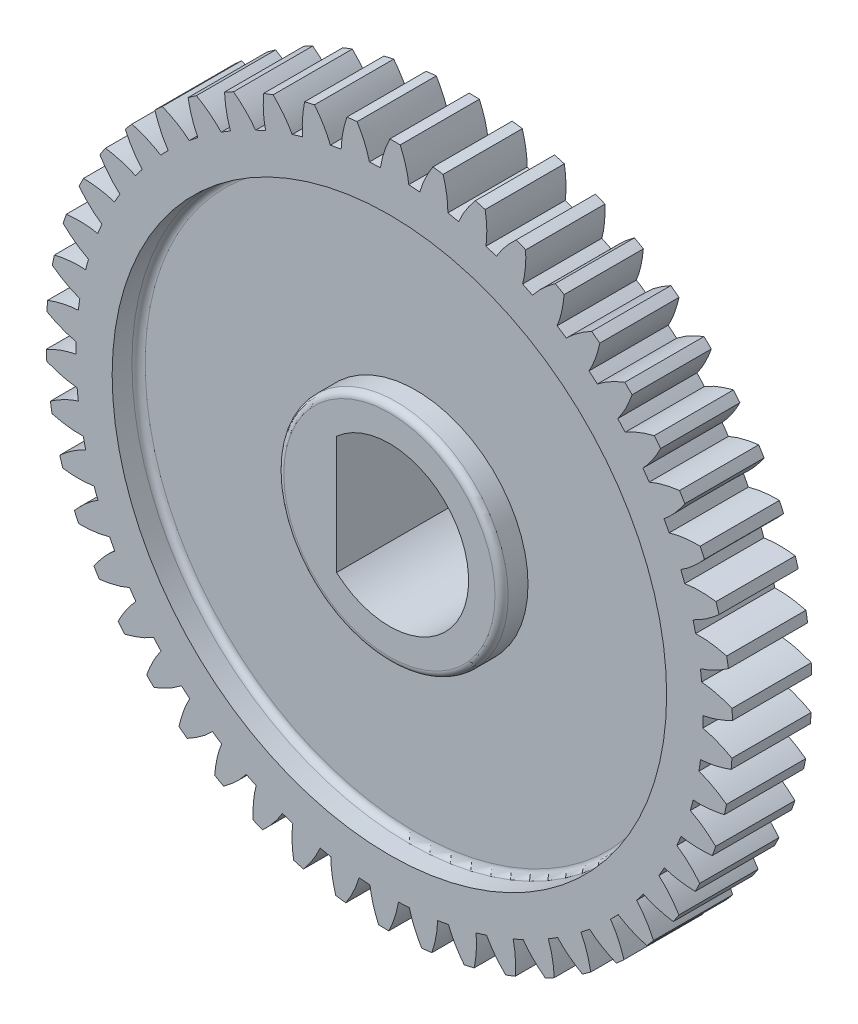
from build123d import *

# Parameters (mm, degrees)
BOSS_EXTRU_1_DEPTH      = 3
ESQUISSE2_R             = 10.5
ESQUISSE2_R_2           = 4.25
ENL_V_MAT_EXTRU_1_DEPTH = 1
ESQUISSE3_R             = 4.25
BOSS_EXTRU_2_DEPTH      = 3.3
BOSS_EXTRU_3_DEPTH      = 1.75
CONG_1_R                = 0.25


with BuildPart() as part:
    # Esquisse1 → Boss.-Extru.1 (new body)
    with BuildSketch(Plane.XY):
        with BuildLine():
            ThreePointArc((12.99358489, 0.408352439), (12.986055843, 0.601958181), (12.975642211, 0.795430209))
            add(Edge.make_bspline(
                [(11.825183943, 1.086577062), (11.84274004, 1.085334297), (12.058734776, 1.065812313), (12.434577724, 0.990975057), (12.793560897, 0.867739829), (12.961964929, 0.800917402), (12.975642211, 0.795430209)],
                knots=[0.129627803, 0.129627803, 0.129627803, 0.129627803, 0.182246376, 0.777177078, 1.275526536, 1.319644943, 1.319644943, 1.319644943, 1.319644943], degree=3))
            ThreePointArc((11.825183943, 1.086577062), (11.804328734, 1.29361824), (11.779848826, 1.500262192))
            add(Edge.make_bspline(
                [(11.779848826, 1.500262192), (11.796719089, 1.505277688), (12.003359366, 1.571115594), (12.354074026, 1.725575182), (12.677847228, 1.923632631), (12.827782192, 2.025341339), (12.83994646, 2.033660468)],
                knots=[0.129627803, 0.129627803, 0.129627803, 0.129627803, 0.182246376, 0.777177078, 1.275526536, 1.319644943, 1.319644943, 1.319644943, 1.319644943], degree=3))
            ThreePointArc((12.83994646, 2.033660468), (12.808211548, 2.22479593), (12.773631556, 2.415437201))
            add(Edge.make_bspline(
                [(11.595754619, 2.560097618), (11.61332804, 2.561065016), (11.830066347, 2.568768287), (12.212325257, 2.541626756), (12.58392321, 2.464355798), (12.759374396, 2.419166907), (12.773631556, 2.415437201)],
                knots=[0.129627803, 0.129627803, 0.129627803, 0.129627803, 0.182246376, 0.777177078, 1.275526536, 1.319644943, 1.319644943, 1.319644943, 1.319644943], degree=3))
            ThreePointArc((11.595754619, 2.560097618), (11.549114719, 2.762892364), (11.498928487, 2.964838721))
            add(Edge.make_bspline(
                [(11.498928487, 2.964838721), (11.515037115, 2.971929073), (11.711796295, 3.063146721), (12.040386545, 3.260344552), (12.336783518, 3.497419801), (12.472788719, 3.617118339), (12.483814405, 3.626896456)],
                knots=[0.129627803, 0.129627803, 0.129627803, 0.129627803, 0.182246376, 0.777177078, 1.275526536, 1.319644943, 1.319644943, 1.319644943, 1.319644943], degree=3))
            ThreePointArc((12.483814405, 3.626896456), (12.428374107, 3.81254732), (12.370173101, 3.997351304))
            add(Edge.make_bspline(
                [(11.183453318, 3.993243906), (11.20076692, 3.996406209), (11.414830705, 4.03121325), (11.797477125, 4.052195484), (12.175829536, 4.022107403), (12.355560907, 3.999264705), (12.370173101, 3.997351304)],
                knots=[0.129627803, 0.129627803, 0.129627803, 0.129627803, 0.182246376, 0.777177078, 1.275526536, 1.319644943, 1.319644943, 1.319644943, 1.319644943], degree=3))
            ThreePointArc((11.183453318, 3.993243906), (11.111764266, 4.188594025), (11.036663178, 4.382657972))
            add(Edge.make_bspline(
                [(11.036663178, 4.382657972), (11.051756128, 4.391711361), (11.235531199, 4.506870195), (11.536814975, 4.74369634), (11.801161363, 5.016050571), (11.921091917, 5.151851223), (11.930805139, 5.162934121)],
                knots=[0.129627803, 0.129627803, 0.129627803, 0.129627803, 0.182246376, 0.777177078, 1.275526536, 1.319644943, 1.319644943, 1.319644943, 1.319644943], degree=3))
            ThreePointArc((11.930805139, 5.162934121), (11.852533781, 5.34017256), (11.771629627, 5.51622479))
            add(Edge.make_bspline(
                [(10.594782277, 5.363414352), (10.611563014, 5.368721689), (10.819576363, 5.430083573), (11.196575731, 5.498858668), (11.575715757, 5.516427972), (11.756892842, 5.516291709), (11.771629627, 5.51622479)],
                knots=[0.129627803, 0.129627803, 0.129627803, 0.129627803, 0.182246376, 0.777177078, 1.275526536, 1.319644943, 1.319644943, 1.319644943, 1.319644943], degree=3))
            ThreePointArc((10.594782277, 5.363414352), (10.499174652, 5.548239056), (10.400343097, 5.731360089))
            add(Edge.make_bspline(
                [(10.400343097, 5.731360089), (10.414182344, 5.742233737), (10.582075065, 5.879517634), (10.851300942, 6.152237204), (11.079427843, 6.455575228), (11.181392374, 6.605336334), (11.189639949, 6.61754923)],
                knots=[0.129627803, 0.129627803, 0.129627803, 0.129627803, 0.182246376, 0.777177078, 1.275526536, 1.319644943, 1.319644943, 1.319644943, 1.319644943], degree=3))
            ThreePointArc((11.189639949, 6.61754923), (11.089771917, 6.783580089), (10.987440521, 6.948104115))
            add(Edge.make_bspline(
                [(9.83902519, 6.649000549), (9.855008421, 6.65636922), (10.053690839, 6.743318233), (10.419097649, 6.858801566), (10.793046025, 6.923751176), (10.972811553, 6.946323498), (10.987440521, 6.948104115)],
                knots=[0.129627803, 0.129627803, 0.129627803, 0.129627803, 0.182246376, 0.777177078, 1.275526536, 1.319644943, 1.319644943, 1.319644943, 1.319644943], degree=3))
            ThreePointArc((9.83902519, 6.649000549), (9.721006783, 6.820385043), (9.600003392, 6.989675233))
            add(Edge.make_bspline(
                [(9.600003392, 6.989675233), (9.612370683, 7.002197657), (9.761733286, 7.159441567), (9.994655411, 7.463753611), (10.182965127, 7.793291607), (10.265355594, 7.954651347), (10.272007452, 7.967801635)],
                knots=[0.129627803, 0.129627803, 0.129627803, 0.129627803, 0.182246376, 0.777177078, 1.275526536, 1.319644943, 1.319644943, 1.319644943, 1.319644943], degree=3))
            ThreePointArc((10.272007452, 7.967801635), (10.152117726, 8.120006508), (10.029972915, 8.270407688))
            add(Edge.make_bspline(
                [(8.928100799, 7.829728036), (8.943034458, 7.839041833), (9.129252605, 7.950206737), (9.477304173, 8.110577067), (9.84016351, 8.221882688), (10.015682471, 8.266807616), (10.029972915, 8.270407688)],
                knots=[0.129627803, 0.129627803, 0.129627803, 0.129627803, 0.182246376, 0.777177078, 1.275526536, 1.319644943, 1.319644943, 1.319644943, 1.319644943], degree=3))
            ThreePointArc((8.928100799, 7.829728036), (8.789532829, 7.984969483), (8.6482659, 8.137759024))
            add(Edge.make_bspline(
                [(8.6482659, 8.137759024), (8.658966195, 8.151732737), (8.787443141, 8.326456829), (8.980388193, 8.657562166), (9.125910968, 9.008103121), (9.187428024, 9.178516755), (9.192379262, 9.192397049)],
                knots=[0.129627803, 0.129627803, 0.129627803, 0.129627803, 0.182246376, 0.777177078, 1.275526536, 1.319644943, 1.319644943, 1.319644943, 1.319644943], degree=3))
            ThreePointArc((9.192379262, 9.192397049), (9.054358573, 9.328375573), (8.914326644, 9.462281991))
            add(Edge.make_bspline(
                [(7.876374925, 8.886976035), (7.890023499, 8.898088073), (8.060840604, 9.031715731), (8.386047949, 9.234443921), (8.732095738, 9.390350199), (8.900600093, 9.456919239), (8.914326644, 9.462281991)],
                knots=[0.129627803, 0.129627803, 0.129627803, 0.129627803, 0.182246376, 0.777177078, 1.275526536, 1.319644943, 1.319644943, 1.319644943, 1.319644943], degree=3))
            ThreePointArc((7.876374925, 8.886976035), (7.719442692, 9.023626185), (7.560140088, 9.157505493))
            add(Edge.make_bspline(
                [(7.560140088, 9.157505493), (7.569004637, 9.172710122), (7.674569769, 9.362158894), (7.824494889, 9.714835793), (7.924935742, 10.080851468), (7.964609225, 10.257631471), (7.96778176, 10.272022869)],
                knots=[0.129627803, 0.129627803, 0.129627803, 0.129627803, 0.182246376, 0.777177078, 1.275526536, 1.319644943, 1.319644943, 1.319644943, 1.319644943], degree=3))
            ThreePointArc((7.96778176, 10.272022869), (7.813806777, 10.389630583), (7.658096117, 10.504930455))
            add(Edge.make_bspline(
                [(6.700433913, 9.804071112), (6.712582157, 9.816806149), (6.865304331, 9.970789173), (7.16253874, 10.212678079), (7.486317601, 10.410726278), (7.645149935, 10.497889597), (7.658096117, 10.504930455)],
                knots=[0.129627803, 0.129627803, 0.129627803, 0.129627803, 0.182246376, 0.777177078, 1.275526536, 1.319644943, 1.319644943, 1.319644943, 1.319644943], degree=3))
            ThreePointArc((6.700433913, 9.804071112), (6.527612333, 9.919974911), (6.35278635, 10.03283263))
            add(Edge.make_bspline(
                [(6.35278635, 10.03283263), (6.359675355, 10.049028389), (6.440663846, 10.25021412), (6.545204626, 10.618900656), (6.598979545, 10.994618766), (6.616183782, 11.174977212), (6.617527579, 11.189652753)],
                knots=[0.129627803, 0.129627803, 0.129627803, 0.129627803, 0.182246376, 0.777177078, 1.275526536, 1.319644943, 1.319644943, 1.319644943, 1.319644943], degree=3))
            ThreePointArc((6.617527579, 11.189652753), (6.45002658, 11.287034913), (6.28109284, 11.38190989))
            add(Edge.make_bspline(
                [(5.418823056, 10.566550132), (5.429279383, 10.580707328), (5.561498107, 10.752617314), (5.826072015, 11.029852203), (6.122475762, 11.266918984), (6.269131196, 11.373301964), (6.28109284, 11.38190989)],
                knots=[0.129627803, 0.129627803, 0.129627803, 0.129627803, 0.182246376, 0.777177078, 1.275526536, 1.319644943, 1.319644943, 1.319644943, 1.319644943], degree=3))
            ThreePointArc((5.418823056, 10.566550132), (5.232837628, 10.659879707), (5.045245377, 10.749936004))
            add(Edge.make_bspline(
                [(5.045245377, 10.749936004), (5.050050193, 10.766867475), (5.105184808, 10.976617346), (5.162692576, 11.355499113), (5.168953499, 11.734994358), (5.163417168, 11.916086886), (5.162911036, 11.930815129)],
                knots=[0.129627803, 0.129627803, 0.129627803, 0.129627803, 0.182246376, 0.777177078, 1.275526536, 1.319644943, 1.319644943, 1.319644943, 1.319644943], degree=3))
            ThreePointArc((5.162911036, 11.930815129), (4.984525611, 12.006435959), (4.805032976, 12.079389806))
            add(Edge.make_bspline(
                [(4.051754122, 11.162388344), (4.060353631, 11.177744431), (4.169983736, 11.364870256), (4.397724655, 11.673078969), (4.662078824, 11.945425647), (4.794244512, 12.069350565), (4.805032976, 12.079389806)],
                knots=[0.129627803, 0.129627803, 0.129627803, 0.129627803, 0.182246376, 0.777177078, 1.275526536, 1.319644943, 1.319644943, 1.319644943, 1.319644943], degree=3))
            ThreePointArc((4.051754122, 11.162388344), (3.855537947, 11.231671832), (3.65813787, 11.297506465))
            add(Edge.make_bspline(
                [(3.65813787, 11.297506465), (3.660782722, 11.31490663), (3.689193955, 11.52991276), (3.698761781, 11.913014565), (3.657409968, 12.290302078), (3.62922038, 12.469272751), (3.626872301, 12.483821423)],
                knots=[0.129627803, 0.129627803, 0.129627803, 0.129627803, 0.182246376, 0.777177078, 1.275526536, 1.319644943, 1.319644943, 1.319644943, 1.319644943], degree=3))
            ThreePointArc((3.626872301, 12.483821423), (3.440415695, 12.536488338), (3.253194872, 12.58637053))
            add(Edge.make_bspline(
                [(2.620786605, 11.582189023), (2.627393676, 11.598501828), (2.712706231, 11.797892405), (2.90002255, 12.132214306), (3.128158117, 12.435545812), (3.243749729, 12.575058298), (3.253194872, 12.58637053)],
                knots=[0.129627803, 0.129627803, 0.129627803, 0.129627803, 0.182246376, 0.777177078, 1.275526536, 1.319644943, 1.319644943, 1.319644943, 1.319644943], degree=3))
            ThreePointArc((2.620786605, 11.582189023), (2.417434129, 11.626333783), (2.213339344, 11.6669085))
            add(Edge.make_bspline(
                [(2.213339344, 11.6669085), (2.213782522, 11.684502947), (2.21502231, 11.901374562), (2.176499302, 12.282654661), (2.088186897, 12.651784393), (2.037788619, 12.825810737), (2.033635623, 12.839950395)],
                knots=[0.129627803, 0.129627803, 0.129627803, 0.129627803, 0.182246376, 0.777177078, 1.275526536, 1.319644943, 1.319644943, 1.319644943, 1.319644943], degree=3))
            ThreePointArc((2.033635623, 12.839950395), (1.842048369, 12.868832807), (1.650051941, 12.894856672))
            add(Edge.make_bspline(
                [(1.148487718, 11.819331663), (1.152998154, 11.836343922), (1.212647728, 12.044854743), (1.356585356, 12.400017376), (1.544904488, 12.729549991), (1.642099075, 12.88244985), (1.650051941, 12.894856672)],
                knots=[0.129627803, 0.129627803, 0.129627803, 0.129627803, 0.182246376, 0.777177078, 1.275526536, 1.319644943, 1.319644943, 1.319644943, 1.319644943], degree=3))
            ThreePointArc((1.148487718, 11.819331663), (0.941205932, 11.837641505), (0.733635134, 11.852316419))
            add(Edge.make_bspline(
                [(0.733635134, 11.852316419), (0.731869648, 11.869827674), (0.70591844, 12.085144577), (0.61991213, 12.458589956), (0.486031871, 12.81374051), (0.414219715, 12.980078025), (0.408327297, 12.99358568)],
                knots=[0.129627803, 0.129627803, 0.129627803, 0.129627803, 0.182246376, 0.777177078, 1.275526536, 1.319644943, 1.319644943, 1.319644943, 1.319644943], degree=3))
            ThreePointArc((0.408327297, 12.99358568), (0.214630839, 12.998228095), (0.020886706, 12.999983221))
            add(Edge.make_bspline(
                [(-0.341923507, 11.870076382), (-0.339580838, 11.887519802), (-0.306534955, 12.101862526), (-0.208245998, 12.472264764), (-0.062713207, 12.822801562), (0.014551537, 12.986677472), (0.020886706, 12.999983221)],
                knots=[0.129627803, 0.129627803, 0.129627803, 0.129627803, 0.182246376, 0.777177078, 1.275526536, 1.319644943, 1.319644943, 1.319644943, 1.319644943], degree=3))
            ThreePointArc((-0.341923507, 11.870076382), (-0.549865646, 11.862262549), (-0.75763894, 11.850806227))
            add(Edge.make_bspline(
                [(-0.75763894, 11.850806227), (-0.761585246, 11.867958127), (-0.814318186, 12.078324643), (-0.946451427, 12.438045845), (-1.123788168, 12.773616285), (-1.215881682, 12.929641729), (-1.223420594, 12.942304356)],
                knots=[0.129627803, 0.129627803, 0.129627803, 0.129627803, 0.182246376, 0.777177078, 1.275526536, 1.319644943, 1.319644943, 1.319644943, 1.319644943], degree=3))
            ThreePointArc((-1.223420594, 12.942304356), (-1.416171547, 12.922633561), (-1.608607925, 12.900092269))
            add(Edge.make_bspline(
                [(-1.826942393, 11.733622906), (-1.826804438, 11.751222393), (-1.820883398, 11.968016709), (-1.769793189, 12.347817087), (-1.669341878, 12.713829893), (-1.613225487, 12.886097433), (-1.608607925, 12.900092269)],
                knots=[0.129627803, 0.129627803, 0.129627803, 0.129627803, 0.182246376, 0.777177078, 1.275526536, 1.319644943, 1.319644943, 1.319644943, 1.319644943], degree=3))
            ThreePointArc((-1.826942393, 11.733622906), (-2.032265513, 11.699808626), (-2.236964595, 11.662401742))
            add(Edge.make_bspline(
                [(-2.236964595, 11.662401742), (-2.243029487, 11.67892379), (-2.321712527, 11.881022314), (-2.49788888, 12.221346321), (-2.715885396, 12.5320445), (-2.826807899, 12.675297259), (-2.835874412, 12.686915162)],
                knots=[0.129627803, 0.129627803, 0.129627803, 0.129627803, 0.182246376, 0.777177078, 1.275526536, 1.319644943, 1.319644943, 1.319644943, 1.319644943], degree=3))
            ThreePointArc((-2.835874412, 12.686915162), (-3.024640061, 12.643241376), (-3.212733849, 12.596759155))
            add(Edge.make_bspline(
                [(-3.283149307, 11.412123187), (-3.28521824, 11.429601187), (-3.306515422, 11.645428118), (-3.303429684, 12.028636958), (-3.24964403, 12.404353531), (-3.215560981, 12.582295939), (-3.212733849, 12.596759155)],
                knots=[0.129627803, 0.129627803, 0.129627803, 0.129627803, 0.182246376, 0.777177078, 1.275526536, 1.319644943, 1.319644943, 1.319644943, 1.319644943], degree=3))
            ThreePointArc((-3.283149307, 11.412123187), (-3.48261534, 11.352841732), (-3.681011983, 11.290074215))
            add(Edge.make_bspline(
                [(-3.681011983, 11.290074215), (-3.689099813, 11.305705849), (-3.792492075, 11.496349166), (-4.009933133, 11.811908864), (-4.265151488, 12.092834888), (-4.393153666, 12.22105578), (-4.403604797, 12.231445736)],
                knots=[0.129627803, 0.129627803, 0.129627803, 0.129627803, 0.182246376, 0.777177078, 1.275526536, 1.319644943, 1.319644943, 1.319644943, 1.319644943], degree=3))
            ThreePointArc((-4.403604797, 12.231445736), (-4.585408195, 12.164457722), (-4.76619304, 12.094767625))
            add(Edge.make_bspline(
                [(-4.687578995, 10.910647468), (-4.691822188, 10.927728343), (-4.740001722, 11.13918417), (-4.78496912, 11.519758039), (-4.778697355, 11.899253104), (-4.767185158, 12.080064121), (-4.76619304, 12.094767625)],
                knots=[0.129627803, 0.129627803, 0.129627803, 0.129627803, 0.182246376, 0.777177078, 1.275526536, 1.319644943, 1.319644943, 1.319644943, 1.319644943], degree=3))
            ThreePointArc((-4.687578995, 10.910647468), (-4.878042242, 10.826833742), (-5.067007613, 10.739695473))
            add(Edge.make_bspline(
                [(-5.067007613, 10.739695473), (-5.076990831, 10.754190173), (-5.203461758, 10.930371724), (-5.458738345, 11.216190549), (-5.747153595, 11.462914045), (-5.890216776, 11.57408095), (-5.901887703, 11.583079105)],
                knots=[0.129627803, 0.129627803, 0.129627803, 0.129627803, 0.182246376, 0.777177078, 1.275526536, 1.319644943, 1.319644943, 1.319644943, 1.319644943], degree=3))
            ThreePointArc((-5.901887703, 11.583079105), (-6.073861703, 11.493833304), (-6.24448652, 11.402034384))
            add(Edge.make_bspline(
                [(-6.018082762, 10.237104321), (-6.024433298, 10.253518695), (-6.098735364, 10.457268632), (-6.191046734, 10.829205653), (-6.232387767, 11.206494348), (-6.243627977, 11.387322477), (-6.24448652, 11.402034384)],
                knots=[0.129627803, 0.129627803, 0.129627803, 0.129627803, 0.182246376, 0.777177078, 1.275526536, 1.319644943, 1.319644943, 1.319644943, 1.319644943], degree=3))
            ThreePointArc((-6.018082762, 10.237104321), (-6.196539504, 10.130080117), (-6.373093505, 10.019945318))
            add(Edge.make_bspline(
                [(-6.373093505, 10.019945318), (-6.38481467, 10.033074494), (-6.53236974, 10.19201579), (-6.821455993, 10.443586208), (-7.138519655, 10.6522162), (-7.294387648, 10.74457595), (-7.307094314, 10.752040396)],
                knots=[0.129627803, 0.129627803, 0.129627803, 0.129627803, 0.182246376, 0.777177078, 1.275526536, 1.319644943, 1.319644943, 1.319644943, 1.319644943], degree=3))
            ThreePointArc((-7.307094314, 10.752040396), (-7.466526783, 10.641944268), (-7.624300717, 10.52948425))
            add(Edge.make_bspline(
                [(-7.253677769, 9.402115923), (-7.262035495, 9.417604932), (-7.361288306, 9.610435722), (-7.499487843, 9.967870226), (-7.587789702, 10.337002481), (-7.621605054, 10.514995954), (-7.624300717, 10.52948425)],
                knots=[0.129627803, 0.129627803, 0.129627803, 0.129627803, 0.182246376, 0.777177078, 1.275526536, 1.319644943, 1.319644943, 1.319644943, 1.319644943], degree=3))
            ThreePointArc((-7.253677769, 9.402115923), (-7.417313637, 9.273569076), (-7.578671906, 9.142174639))
            add(Edge.make_bspline(
                [(-7.578671906, 9.142174639), (-7.591946169, 9.153731237), (-7.758258349, 9.292925679), (-8.076595204, 9.506280274), (-8.417306997, 9.673526543), (-8.58352167, 9.745622569), (-8.597063683, 9.751435588)],
                knots=[0.129627803, 0.129627803, 0.129627803, 0.129627803, 0.182246376, 0.777177078, 1.275526536, 1.319644943, 1.319644943, 1.319644943, 1.319644943], degree=3))
            ThreePointArc((-8.597063683, 9.751435588), (-8.741440276, 9.622225413), (-8.883875138, 9.490877859))
            add(Edge.make_bspline(
                [(-8.374877944, 8.418850541), (-8.385111055, 8.433169913), (-8.507749334, 8.612040499), (-8.689657548, 8.949335531), (-8.82352766, 9.30448991), (-8.879384865, 9.476841664), (-8.883875138, 9.490877859)],
                knots=[0.129627803, 0.129627803, 0.129627803, 0.129627803, 0.182246376, 0.777177078, 1.275526536, 1.319644943, 1.319644943, 1.319644943, 1.319644943], degree=3))
            ThreePointArc((-8.374877944, 8.418850541), (-8.521112302, 8.270808312), (-8.664730124, 8.120226406))
            add(Edge.make_bspline(
                [(-8.664730124, 8.120226406), (-8.679348141, 8.130028169), (-8.861794589, 8.247280579), (-9.204361685, 8.419054622), (-9.563348378, 8.542279593), (-9.737288428, 8.592974898), (-9.751452223, 8.597044815)],
                knots=[0.129627803, 0.129627803, 0.129627803, 0.129627803, 0.182246376, 0.777177078, 1.275526536, 1.319644943, 1.319644943, 1.319644943, 1.319644943], degree=3))
            ThreePointArc((-9.751452223, 8.597044815), (-9.878496034, 8.450758316), (-10.00334554, 8.302594655))
            add(Edge.make_bspline(
                [(-9.364001291, 7.302814856), (-9.375948404, 7.315738767), (-9.520038073, 7.477828253), (-9.742786163, 7.789664468), (-9.920113316, 8.125239975), (-9.997131473, 8.28923192), (-10.00334554, 8.302594655)],
                knots=[0.129627803, 0.129627803, 0.129627803, 0.129627803, 0.182246376, 0.777177078, 1.275526536, 1.319644943, 1.319644943, 1.319644943, 1.319644943], degree=3))
            ThreePointArc((-9.364001291, 7.302814856), (-9.490527937, 7.137611959), (-9.614140372, 6.970217351))
            add(Edge.make_bspline(
                [(-9.614140372, 6.970217351), (-9.629871608, 6.978109701), (-9.825575035, 7.071570937), (-10.186969883, 7.199055449), (-10.558570043, 7.276315791), (-10.73749233, 7.304810879), (-10.752054535, 7.30707351)],
                knots=[0.129627803, 0.129627803, 0.129627803, 0.129627803, 0.182246376, 0.777177078, 1.275526536, 1.319644943, 1.319644943, 1.319644943, 1.319644943], degree=3))
            ThreePointArc((-10.752054535, 7.30707351), (-10.859762008, 7.146017712), (-10.965057208, 6.983374573))
            add(Edge.make_bspline(
                [(-10.205448744, 6.071609419), (-10.218921446, 6.082934051), (-10.382190124, 6.225686188), (-10.642265221, 6.507145743), (-10.860252859, 6.817850151), (-10.957217346, 6.970896036), (-10.965057208, 6.983374573)],
                knots=[0.129627803, 0.129627803, 0.129627803, 0.129627803, 0.182246376, 0.777177078, 1.275526536, 1.319644943, 1.319644943, 1.319644943, 1.319644943], degree=3))
            ThreePointArc((-10.205448744, 6.071609419), (-10.310272276, 5.891851203), (-10.411929882, 5.710283804))
            add(Edge.make_bspline(
                [(-10.411929882, 5.710283804), (-10.428526247, 5.716142275), (-10.634400293, 5.784338398), (-11.008923481, 5.865522871), (-11.387276751, 5.895600142), (-11.568359564, 5.90144563), (-11.583090524, 5.90186529)],
                knots=[0.129627803, 0.129627803, 0.129627803, 0.129627803, 0.182246376, 0.777177078, 1.275526536, 1.319644943, 1.319644943, 1.319644943, 1.319644943], degree=3))
            ThreePointArc((-11.583090524, 5.90186529), (-11.669763047, 5.72858014), (-11.753843373, 5.554022503))
            add(Edge.make_bspline(
                [(-10.885950174, 4.744651074), (-10.900735992, 4.754197831), (-11.080608835, 4.875361334), (-11.373909398, 5.122005443), (-11.629119727, 5.402938758), (-11.744501355, 5.542624958), (-11.753843373, 5.554022503)],
                knots=[0.129627803, 0.129627803, 0.129627803, 0.129627803, 0.182246376, 0.777177078, 1.275526536, 1.319644943, 1.319644943, 1.319644943, 1.319644943], degree=3))
            ThreePointArc((-10.885950174, 4.744651074), (-10.967417462, 4.553172433), (-11.045517039, 4.360295671))
            add(Edge.make_bspline(
                [(-11.045517039, 4.360295671), (-11.062716797, 4.36402787), (-11.275514706, 4.405883386), (-11.657259779, 4.439487493), (-12.036399302, 4.421907357), (-12.216786857, 4.405011057), (-12.231454257, 4.40358113)],
                knots=[0.129627803, 0.129627803, 0.129627803, 0.129627803, 0.182246376, 0.777177078, 1.275526536, 1.319644943, 1.319644943, 1.319644943, 1.319644943], degree=3))
            ThreePointArc((-12.231454257, 4.40358113), (-12.295724953, 4.220799436), (-12.357264407, 4.03708018))
            add(Edge.make_bspline(
                [(-11.394773666, 3.342866747), (-11.41063942, 3.35048507), (-11.604279725, 3.448149118), (-11.926180229, 3.656088057), (-12.21458843, 3.902819794), (-12.346567563, 4.026943374), (-12.357264407, 4.03708018)],
                knots=[0.129627803, 0.129627803, 0.129627803, 0.129627803, 0.182246376, 0.777177078, 1.275526536, 1.319644943, 1.319644943, 1.319644943, 1.319644943], degree=3))
            ThreePointArc((-11.394773666, 3.342866747), (-11.451599924, 3.142687414), (-11.504909794, 2.94154307))
            add(Edge.make_bspline(
                [(-11.504909794, 2.94154307), (-11.522441695, 2.943090138), (-11.738807516, 2.957944961), (-12.121754126, 2.943438745), (-12.495700646, 2.878478452), (-12.672548123, 2.839106828), (-12.686920649, 2.835849864)],
                knots=[0.129627803, 0.129627803, 0.129627803, 0.129627803, 0.182246376, 0.777177078, 1.275526536, 1.319644943, 1.319644943, 1.319644943, 1.319644943], degree=3))
            ThreePointArc((-12.686920649, 2.835849864), (-12.727775931, 2.646454205), (-12.765803999, 2.456470691))
            add(Edge.make_bspline(
                [(-11.723894771, 1.888363415), (-11.740590248, 1.893933159), (-11.944944193, 1.966557531), (-12.290368075, 2.132511978), (-12.607425776, 2.341151029), (-12.753921024, 2.447754486), (-12.765803999, 2.456470691)],
                knots=[0.129627803, 0.129627803, 0.129627803, 0.129627803, 0.182246376, 0.777177078, 1.275526536, 1.319644943, 1.319644943, 1.319644943, 1.319644943], degree=3))
            ThreePointArc((-11.723894771, 1.888363415), (-11.755183814, 1.682640337), (-11.782863248, 1.476400578))
            add(Edge.make_bspline(
                [(-11.782863248, 1.476400578), (-11.800450805, 1.475738117), (-12.016972319, 1.463357978), (-12.39508117, 1.400970211), (-12.757937327, 1.289654222), (-12.928455735, 1.228428189), (-12.942306723, 1.223395552)],
                knots=[0.129627803, 0.129627803, 0.129627803, 0.129627803, 0.182246376, 0.777177078, 1.275526536, 1.319644943, 1.319644943, 1.319644943, 1.319644943], degree=3))
            ThreePointArc((-12.942306723, 1.223395552), (-12.959102279, 1.03037281), (-12.973019237, 0.837121191))
            add(Edge.make_bspline(
                [(-11.868123052, 0.404079464), (-11.885384954, 0.407512791), (-12.097229754, 0.453952157), (-12.460729473, 0.575304912), (-12.801436487, 0.742560915), (-12.960137532, 0.829963048), (-12.973019237, 0.837121191)],
                knots=[0.129627803, 0.129627803, 0.129627803, 0.129627803, 0.182246376, 0.777177078, 1.275526536, 1.319644943, 1.319644943, 1.319644943, 1.319644943], degree=3))
            ThreePointArc((-11.868123052, 0.404079464), (-11.873381433, 0.196057017), (-11.874993911, -0.012025633))
            add(Edge.make_bspline(
                [(-11.874993911, -0.012025633), (-11.892359755, -0.014887175), (-12.10562229, -0.054307035), (-12.47293038, -0.163592461), (-12.818973714, -0.319508626), (-12.980473877, -0.401623496), (-12.99358489, -0.408352439)],
                knots=[0.129627803, 0.129627803, 0.129627803, 0.129627803, 0.182246376, 0.777177078, 1.275526536, 1.319644943, 1.319644943, 1.319644943, 1.319644943], degree=3))
            ThreePointArc((-12.99358489, -0.408352439), (-12.986055843, -0.601958181), (-12.975642211, -0.795430209))
            add(Edge.make_bspline(
                [(-11.825183943, -1.086577062), (-11.84274004, -1.085334297), (-12.058734776, -1.065812313), (-12.434577724, -0.990975057), (-12.793560897, -0.867739829), (-12.961964929, -0.800917402), (-12.975642211, -0.795430209)],
                knots=[0.129627803, 0.129627803, 0.129627803, 0.129627803, 0.182246376, 0.777177078, 1.275526536, 1.319644943, 1.319644943, 1.319644943, 1.319644943], degree=3))
            ThreePointArc((-11.825183943, -1.086577062), (-11.804328734, -1.29361824), (-11.779848826, -1.500262192))
            add(Edge.make_bspline(
                [(-11.779848826, -1.500262192), (-11.796719089, -1.505277688), (-12.003359366, -1.571115594), (-12.354074026, -1.725575182), (-12.677847228, -1.923632631), (-12.827782192, -2.025341339), (-12.83994646, -2.033660468)],
                knots=[0.129627803, 0.129627803, 0.129627803, 0.129627803, 0.182246376, 0.777177078, 1.275526536, 1.319644943, 1.319644943, 1.319644943, 1.319644943], degree=3))
            ThreePointArc((-12.83994646, -2.033660468), (-12.808211548, -2.22479593), (-12.773631556, -2.415437201))
            add(Edge.make_bspline(
                [(-11.595754619, -2.560097618), (-11.61332804, -2.561065016), (-11.830066347, -2.568768287), (-12.212325257, -2.541626756), (-12.58392321, -2.464355798), (-12.759374396, -2.419166907), (-12.773631556, -2.415437201)],
                knots=[0.129627803, 0.129627803, 0.129627803, 0.129627803, 0.182246376, 0.777177078, 1.275526536, 1.319644943, 1.319644943, 1.319644943, 1.319644943], degree=3))
            ThreePointArc((-11.595754619, -2.560097618), (-11.549114719, -2.762892364), (-11.498928487, -2.964838721))
            add(Edge.make_bspline(
                [(-11.498928487, -2.964838721), (-11.515037115, -2.971929073), (-11.711796295, -3.063146721), (-12.040386545, -3.260344552), (-12.336783518, -3.497419801), (-12.472788719, -3.617118339), (-12.483814405, -3.626896456)],
                knots=[0.129627803, 0.129627803, 0.129627803, 0.129627803, 0.182246376, 0.777177078, 1.275526536, 1.319644943, 1.319644943, 1.319644943, 1.319644943], degree=3))
            ThreePointArc((-12.483814405, -3.626896456), (-12.428374107, -3.81254732), (-12.370173101, -3.997351304))
            add(Edge.make_bspline(
                [(-11.183453318, -3.993243906), (-11.20076692, -3.996406209), (-11.414830705, -4.03121325), (-11.797477125, -4.052195484), (-12.175829536, -4.022107403), (-12.355560907, -3.999264705), (-12.370173101, -3.997351304)],
                knots=[0.129627803, 0.129627803, 0.129627803, 0.129627803, 0.182246376, 0.777177078, 1.275526536, 1.319644943, 1.319644943, 1.319644943, 1.319644943], degree=3))
            ThreePointArc((-11.183453318, -3.993243906), (-11.111764266, -4.188594025), (-11.036663178, -4.382657972))
            add(Edge.make_bspline(
                [(-11.036663178, -4.382657972), (-11.051756128, -4.391711361), (-11.235531199, -4.506870195), (-11.536814975, -4.74369634), (-11.801161363, -5.016050571), (-11.921091917, -5.151851223), (-11.930805139, -5.162934121)],
                knots=[0.129627803, 0.129627803, 0.129627803, 0.129627803, 0.182246376, 0.777177078, 1.275526536, 1.319644943, 1.319644943, 1.319644943, 1.319644943], degree=3))
            ThreePointArc((-11.930805139, -5.162934121), (-11.852533781, -5.34017256), (-11.771629627, -5.51622479))
            add(Edge.make_bspline(
                [(-10.594782277, -5.363414352), (-10.611563014, -5.368721689), (-10.819576363, -5.430083573), (-11.196575731, -5.498858668), (-11.575715757, -5.516427972), (-11.756892842, -5.516291709), (-11.771629627, -5.51622479)],
                knots=[0.129627803, 0.129627803, 0.129627803, 0.129627803, 0.182246376, 0.777177078, 1.275526536, 1.319644943, 1.319644943, 1.319644943, 1.319644943], degree=3))
            ThreePointArc((-10.594782277, -5.363414352), (-10.499174652, -5.548239056), (-10.400343097, -5.731360089))
            add(Edge.make_bspline(
                [(-10.400343097, -5.731360089), (-10.414182344, -5.742233737), (-10.582075065, -5.879517634), (-10.851300942, -6.152237204), (-11.079427843, -6.455575228), (-11.181392374, -6.605336334), (-11.189639949, -6.61754923)],
                knots=[0.129627803, 0.129627803, 0.129627803, 0.129627803, 0.182246376, 0.777177078, 1.275526536, 1.319644943, 1.319644943, 1.319644943, 1.319644943], degree=3))
            ThreePointArc((-11.189639949, -6.61754923), (-11.089771917, -6.783580089), (-10.987440521, -6.948104115))
            add(Edge.make_bspline(
                [(-9.83902519, -6.649000549), (-9.855008421, -6.65636922), (-10.053690839, -6.743318233), (-10.419097649, -6.858801566), (-10.793046025, -6.923751176), (-10.972811553, -6.946323498), (-10.987440521, -6.948104115)],
                knots=[0.129627803, 0.129627803, 0.129627803, 0.129627803, 0.182246376, 0.777177078, 1.275526536, 1.319644943, 1.319644943, 1.319644943, 1.319644943], degree=3))
            ThreePointArc((-9.83902519, -6.649000549), (-9.721006783, -6.820385043), (-9.600003392, -6.989675233))
            add(Edge.make_bspline(
                [(-9.600003392, -6.989675233), (-9.612370683, -7.002197657), (-9.761733286, -7.159441567), (-9.994655411, -7.463753611), (-10.182965127, -7.793291607), (-10.265355594, -7.954651347), (-10.272007452, -7.967801635)],
                knots=[0.129627803, 0.129627803, 0.129627803, 0.129627803, 0.182246376, 0.777177078, 1.275526536, 1.319644943, 1.319644943, 1.319644943, 1.319644943], degree=3))
            ThreePointArc((-10.272007452, -7.967801635), (-10.152117726, -8.120006508), (-10.029972915, -8.270407688))
            add(Edge.make_bspline(
                [(-8.928100799, -7.829728036), (-8.943034458, -7.839041833), (-9.129252605, -7.950206737), (-9.477304173, -8.110577067), (-9.84016351, -8.221882688), (-10.015682471, -8.266807616), (-10.029972915, -8.270407688)],
                knots=[0.129627803, 0.129627803, 0.129627803, 0.129627803, 0.182246376, 0.777177078, 1.275526536, 1.319644943, 1.319644943, 1.319644943, 1.319644943], degree=3))
            ThreePointArc((-8.928100799, -7.829728036), (-8.789532829, -7.984969483), (-8.6482659, -8.137759024))
            add(Edge.make_bspline(
                [(-8.6482659, -8.137759024), (-8.658966195, -8.151732737), (-8.787443141, -8.326456829), (-8.980388193, -8.657562166), (-9.125910968, -9.008103121), (-9.187428024, -9.178516755), (-9.192379262, -9.192397049)],
                knots=[0.129627803, 0.129627803, 0.129627803, 0.129627803, 0.182246376, 0.777177078, 1.275526536, 1.319644943, 1.319644943, 1.319644943, 1.319644943], degree=3))
            ThreePointArc((-9.192379262, -9.192397049), (-9.054358573, -9.328375573), (-8.914326644, -9.462281991))
            add(Edge.make_bspline(
                [(-7.876374925, -8.886976035), (-7.890023499, -8.898088073), (-8.060840604, -9.031715731), (-8.386047949, -9.234443921), (-8.732095738, -9.390350199), (-8.900600093, -9.456919239), (-8.914326644, -9.462281991)],
                knots=[0.129627803, 0.129627803, 0.129627803, 0.129627803, 0.182246376, 0.777177078, 1.275526536, 1.319644943, 1.319644943, 1.319644943, 1.319644943], degree=3))
            ThreePointArc((-7.876374925, -8.886976035), (-7.719442692, -9.023626185), (-7.560140088, -9.157505493))
            add(Edge.make_bspline(
                [(-7.560140088, -9.157505493), (-7.569004637, -9.172710122), (-7.674569769, -9.362158894), (-7.824494889, -9.714835793), (-7.924935742, -10.080851468), (-7.964609225, -10.257631471), (-7.96778176, -10.272022869)],
                knots=[0.129627803, 0.129627803, 0.129627803, 0.129627803, 0.182246376, 0.777177078, 1.275526536, 1.319644943, 1.319644943, 1.319644943, 1.319644943], degree=3))
            ThreePointArc((-7.96778176, -10.272022869), (-7.813806777, -10.389630583), (-7.658096117, -10.504930455))
            add(Edge.make_bspline(
                [(-6.700433913, -9.804071112), (-6.712582157, -9.816806149), (-6.865304331, -9.970789173), (-7.16253874, -10.212678079), (-7.486317601, -10.410726278), (-7.645149935, -10.497889597), (-7.658096117, -10.504930455)],
                knots=[0.129627803, 0.129627803, 0.129627803, 0.129627803, 0.182246376, 0.777177078, 1.275526536, 1.319644943, 1.319644943, 1.319644943, 1.319644943], degree=3))
            ThreePointArc((-6.700433913, -9.804071112), (-6.527612333, -9.919974911), (-6.35278635, -10.03283263))
            add(Edge.make_bspline(
                [(-6.35278635, -10.03283263), (-6.359675355, -10.049028389), (-6.440663846, -10.25021412), (-6.545204626, -10.618900656), (-6.598979545, -10.994618766), (-6.616183782, -11.174977212), (-6.617527579, -11.189652753)],
                knots=[0.129627803, 0.129627803, 0.129627803, 0.129627803, 0.182246376, 0.777177078, 1.275526536, 1.319644943, 1.319644943, 1.319644943, 1.319644943], degree=3))
            ThreePointArc((-6.617527579, -11.189652753), (-6.45002658, -11.287034913), (-6.28109284, -11.38190989))
            add(Edge.make_bspline(
                [(-5.418823056, -10.566550132), (-5.429279383, -10.580707328), (-5.561498107, -10.752617314), (-5.826072015, -11.029852203), (-6.122475762, -11.266918984), (-6.269131196, -11.373301964), (-6.28109284, -11.38190989)],
                knots=[0.129627803, 0.129627803, 0.129627803, 0.129627803, 0.182246376, 0.777177078, 1.275526536, 1.319644943, 1.319644943, 1.319644943, 1.319644943], degree=3))
            ThreePointArc((-5.418823056, -10.566550132), (-5.232837628, -10.659879707), (-5.045245377, -10.749936004))
            add(Edge.make_bspline(
                [(-5.045245377, -10.749936004), (-5.050050193, -10.766867475), (-5.105184808, -10.976617346), (-5.162692576, -11.355499113), (-5.168953499, -11.734994358), (-5.163417168, -11.916086886), (-5.162911036, -11.930815129)],
                knots=[0.129627803, 0.129627803, 0.129627803, 0.129627803, 0.182246376, 0.777177078, 1.275526536, 1.319644943, 1.319644943, 1.319644943, 1.319644943], degree=3))
            ThreePointArc((-5.162911036, -11.930815129), (-4.984525611, -12.006435959), (-4.805032976, -12.079389806))
            add(Edge.make_bspline(
                [(-4.051754122, -11.162388344), (-4.060353631, -11.177744431), (-4.169983736, -11.364870256), (-4.397724655, -11.673078969), (-4.662078824, -11.945425647), (-4.794244512, -12.069350565), (-4.805032976, -12.079389806)],
                knots=[0.129627803, 0.129627803, 0.129627803, 0.129627803, 0.182246376, 0.777177078, 1.275526536, 1.319644943, 1.319644943, 1.319644943, 1.319644943], degree=3))
            ThreePointArc((-4.051754122, -11.162388344), (-3.855537947, -11.231671832), (-3.65813787, -11.297506465))
            add(Edge.make_bspline(
                [(-3.65813787, -11.297506465), (-3.660782722, -11.31490663), (-3.689193955, -11.52991276), (-3.698761781, -11.913014565), (-3.657409968, -12.290302078), (-3.62922038, -12.469272751), (-3.626872301, -12.483821423)],
                knots=[0.129627803, 0.129627803, 0.129627803, 0.129627803, 0.182246376, 0.777177078, 1.275526536, 1.319644943, 1.319644943, 1.319644943, 1.319644943], degree=3))
            ThreePointArc((-3.626872301, -12.483821423), (-3.440415695, -12.536488338), (-3.253194872, -12.58637053))
            add(Edge.make_bspline(
                [(-2.620786605, -11.582189023), (-2.627393676, -11.598501828), (-2.712706231, -11.797892405), (-2.90002255, -12.132214306), (-3.128158117, -12.435545812), (-3.243749729, -12.575058298), (-3.253194872, -12.58637053)],
                knots=[0.129627803, 0.129627803, 0.129627803, 0.129627803, 0.182246376, 0.777177078, 1.275526536, 1.319644943, 1.319644943, 1.319644943, 1.319644943], degree=3))
            ThreePointArc((-2.620786605, -11.582189023), (-2.417434129, -11.626333783), (-2.213339344, -11.6669085))
            add(Edge.make_bspline(
                [(-2.213339344, -11.6669085), (-2.213782522, -11.684502947), (-2.21502231, -11.901374562), (-2.176499302, -12.282654661), (-2.088186897, -12.651784393), (-2.037788619, -12.825810737), (-2.033635623, -12.839950395)],
                knots=[0.129627803, 0.129627803, 0.129627803, 0.129627803, 0.182246376, 0.777177078, 1.275526536, 1.319644943, 1.319644943, 1.319644943, 1.319644943], degree=3))
            ThreePointArc((-2.033635623, -12.839950395), (-1.842048369, -12.868832807), (-1.650051941, -12.894856672))
            add(Edge.make_bspline(
                [(-1.148487718, -11.819331663), (-1.152998154, -11.836343922), (-1.212647728, -12.044854743), (-1.356585356, -12.400017376), (-1.544904488, -12.729549991), (-1.642099075, -12.88244985), (-1.650051941, -12.894856672)],
                knots=[0.129627803, 0.129627803, 0.129627803, 0.129627803, 0.182246376, 0.777177078, 1.275526536, 1.319644943, 1.319644943, 1.319644943, 1.319644943], degree=3))
            ThreePointArc((-1.148487718, -11.819331663), (-0.941205932, -11.837641505), (-0.733635134, -11.852316419))
            add(Edge.make_bspline(
                [(-0.733635134, -11.852316419), (-0.731869648, -11.869827674), (-0.70591844, -12.085144577), (-0.61991213, -12.458589956), (-0.486031871, -12.81374051), (-0.414219715, -12.980078025), (-0.408327297, -12.99358568)],
                knots=[0.129627803, 0.129627803, 0.129627803, 0.129627803, 0.182246376, 0.777177078, 1.275526536, 1.319644943, 1.319644943, 1.319644943, 1.319644943], degree=3))
            ThreePointArc((-0.408327297, -12.99358568), (-0.214630839, -12.998228095), (-0.020886706, -12.999983221))
            add(Edge.make_bspline(
                [(0.341923507, -11.870076382), (0.339580838, -11.887519802), (0.306534955, -12.101862526), (0.208245998, -12.472264764), (0.062713207, -12.822801562), (-0.014551537, -12.986677472), (-0.020886706, -12.999983221)],
                knots=[0.129627803, 0.129627803, 0.129627803, 0.129627803, 0.182246376, 0.777177078, 1.275526536, 1.319644943, 1.319644943, 1.319644943, 1.319644943], degree=3))
            ThreePointArc((0.341923507, -11.870076382), (0.549865646, -11.862262549), (0.75763894, -11.850806227))
            add(Edge.make_bspline(
                [(0.75763894, -11.850806227), (0.761585246, -11.867958127), (0.814318186, -12.078324643), (0.946451427, -12.438045845), (1.123788168, -12.773616285), (1.215881682, -12.929641729), (1.223420594, -12.942304356)],
                knots=[0.129627803, 0.129627803, 0.129627803, 0.129627803, 0.182246376, 0.777177078, 1.275526536, 1.319644943, 1.319644943, 1.319644943, 1.319644943], degree=3))
            ThreePointArc((1.223420594, -12.942304356), (1.416171547, -12.922633561), (1.608607925, -12.900092269))
            add(Edge.make_bspline(
                [(1.826942393, -11.733622906), (1.826804438, -11.751222393), (1.820883398, -11.968016709), (1.769793189, -12.347817087), (1.669341878, -12.713829893), (1.613225487, -12.886097433), (1.608607925, -12.900092269)],
                knots=[0.129627803, 0.129627803, 0.129627803, 0.129627803, 0.182246376, 0.777177078, 1.275526536, 1.319644943, 1.319644943, 1.319644943, 1.319644943], degree=3))
            ThreePointArc((1.826942393, -11.733622906), (2.032265513, -11.699808626), (2.236964595, -11.662401742))
            add(Edge.make_bspline(
                [(2.236964595, -11.662401742), (2.243029487, -11.67892379), (2.321712527, -11.881022314), (2.49788888, -12.221346321), (2.715885396, -12.5320445), (2.826807899, -12.675297259), (2.835874412, -12.686915162)],
                knots=[0.129627803, 0.129627803, 0.129627803, 0.129627803, 0.182246376, 0.777177078, 1.275526536, 1.319644943, 1.319644943, 1.319644943, 1.319644943], degree=3))
            ThreePointArc((2.835874412, -12.686915162), (3.024640061, -12.643241376), (3.212733849, -12.596759155))
            add(Edge.make_bspline(
                [(3.283149307, -11.412123187), (3.28521824, -11.429601187), (3.306515422, -11.645428118), (3.303429684, -12.028636958), (3.24964403, -12.404353531), (3.215560981, -12.582295939), (3.212733849, -12.596759155)],
                knots=[0.129627803, 0.129627803, 0.129627803, 0.129627803, 0.182246376, 0.777177078, 1.275526536, 1.319644943, 1.319644943, 1.319644943, 1.319644943], degree=3))
            ThreePointArc((3.283149307, -11.412123187), (3.48261534, -11.352841732), (3.681011983, -11.290074215))
            add(Edge.make_bspline(
                [(3.681011983, -11.290074215), (3.689099813, -11.305705849), (3.792492075, -11.496349166), (4.009933133, -11.811908864), (4.265151488, -12.092834888), (4.393153666, -12.22105578), (4.403604797, -12.231445736)],
                knots=[0.129627803, 0.129627803, 0.129627803, 0.129627803, 0.182246376, 0.777177078, 1.275526536, 1.319644943, 1.319644943, 1.319644943, 1.319644943], degree=3))
            ThreePointArc((4.403604797, -12.231445736), (4.585408195, -12.164457722), (4.76619304, -12.094767625))
            add(Edge.make_bspline(
                [(4.687578995, -10.910647468), (4.691822188, -10.927728343), (4.740001722, -11.13918417), (4.78496912, -11.519758039), (4.778697355, -11.899253104), (4.767185158, -12.080064121), (4.76619304, -12.094767625)],
                knots=[0.129627803, 0.129627803, 0.129627803, 0.129627803, 0.182246376, 0.777177078, 1.275526536, 1.319644943, 1.319644943, 1.319644943, 1.319644943], degree=3))
            ThreePointArc((4.687578995, -10.910647468), (4.878042242, -10.826833742), (5.067007613, -10.739695473))
            add(Edge.make_bspline(
                [(5.067007613, -10.739695473), (5.076990831, -10.754190173), (5.203461758, -10.930371724), (5.458738345, -11.216190549), (5.747153595, -11.462914045), (5.890216776, -11.57408095), (5.901887703, -11.583079105)],
                knots=[0.129627803, 0.129627803, 0.129627803, 0.129627803, 0.182246376, 0.777177078, 1.275526536, 1.319644943, 1.319644943, 1.319644943, 1.319644943], degree=3))
            ThreePointArc((5.901887703, -11.583079105), (6.073861703, -11.493833304), (6.24448652, -11.402034384))
            add(Edge.make_bspline(
                [(6.018082762, -10.237104321), (6.024433298, -10.253518695), (6.098735364, -10.457268632), (6.191046734, -10.829205653), (6.232387767, -11.206494348), (6.243627977, -11.387322477), (6.24448652, -11.402034384)],
                knots=[0.129627803, 0.129627803, 0.129627803, 0.129627803, 0.182246376, 0.777177078, 1.275526536, 1.319644943, 1.319644943, 1.319644943, 1.319644943], degree=3))
            ThreePointArc((6.018082762, -10.237104321), (6.196539504, -10.130080117), (6.373093505, -10.019945318))
            add(Edge.make_bspline(
                [(6.373093505, -10.019945318), (6.38481467, -10.033074494), (6.53236974, -10.19201579), (6.821455993, -10.443586208), (7.138519655, -10.6522162), (7.294387648, -10.74457595), (7.307094314, -10.752040396)],
                knots=[0.129627803, 0.129627803, 0.129627803, 0.129627803, 0.182246376, 0.777177078, 1.275526536, 1.319644943, 1.319644943, 1.319644943, 1.319644943], degree=3))
            ThreePointArc((7.307094314, -10.752040396), (7.466526783, -10.641944268), (7.624300717, -10.52948425))
            add(Edge.make_bspline(
                [(7.253677769, -9.402115923), (7.262035495, -9.417604932), (7.361288306, -9.610435722), (7.499487843, -9.967870226), (7.587789702, -10.337002481), (7.621605054, -10.514995954), (7.624300717, -10.52948425)],
                knots=[0.129627803, 0.129627803, 0.129627803, 0.129627803, 0.182246376, 0.777177078, 1.275526536, 1.319644943, 1.319644943, 1.319644943, 1.319644943], degree=3))
            ThreePointArc((7.253677769, -9.402115923), (7.417313637, -9.273569076), (7.578671906, -9.142174639))
            add(Edge.make_bspline(
                [(7.578671906, -9.142174639), (7.591946169, -9.153731237), (7.758258349, -9.292925679), (8.076595204, -9.506280274), (8.417306997, -9.673526543), (8.58352167, -9.745622569), (8.597063683, -9.751435588)],
                knots=[0.129627803, 0.129627803, 0.129627803, 0.129627803, 0.182246376, 0.777177078, 1.275526536, 1.319644943, 1.319644943, 1.319644943, 1.319644943], degree=3))
            ThreePointArc((8.597063683, -9.751435588), (8.741440276, -9.622225413), (8.883875138, -9.490877859))
            add(Edge.make_bspline(
                [(8.374877944, -8.418850541), (8.385111055, -8.433169913), (8.507749334, -8.612040499), (8.689657548, -8.949335531), (8.82352766, -9.30448991), (8.879384865, -9.476841664), (8.883875138, -9.490877859)],
                knots=[0.129627803, 0.129627803, 0.129627803, 0.129627803, 0.182246376, 0.777177078, 1.275526536, 1.319644943, 1.319644943, 1.319644943, 1.319644943], degree=3))
            ThreePointArc((8.374877944, -8.418850541), (8.521112302, -8.270808312), (8.664730124, -8.120226406))
            add(Edge.make_bspline(
                [(8.664730124, -8.120226406), (8.679348141, -8.130028169), (8.861794589, -8.247280579), (9.204361685, -8.419054622), (9.563348378, -8.542279593), (9.737288428, -8.592974898), (9.751452223, -8.597044815)],
                knots=[0.129627803, 0.129627803, 0.129627803, 0.129627803, 0.182246376, 0.777177078, 1.275526536, 1.319644943, 1.319644943, 1.319644943, 1.319644943], degree=3))
            ThreePointArc((9.751452223, -8.597044815), (9.878496034, -8.450758316), (10.00334554, -8.302594655))
            add(Edge.make_bspline(
                [(9.364001291, -7.302814856), (9.375948404, -7.315738767), (9.520038073, -7.477828253), (9.742786163, -7.789664468), (9.920113316, -8.125239975), (9.997131473, -8.28923192), (10.00334554, -8.302594655)],
                knots=[0.129627803, 0.129627803, 0.129627803, 0.129627803, 0.182246376, 0.777177078, 1.275526536, 1.319644943, 1.319644943, 1.319644943, 1.319644943], degree=3))
            ThreePointArc((9.364001291, -7.302814856), (9.490527937, -7.137611959), (9.614140372, -6.970217351))
            add(Edge.make_bspline(
                [(9.614140372, -6.970217351), (9.629871608, -6.978109701), (9.825575035, -7.071570937), (10.186969883, -7.199055449), (10.558570043, -7.276315791), (10.73749233, -7.304810879), (10.752054535, -7.30707351)],
                knots=[0.129627803, 0.129627803, 0.129627803, 0.129627803, 0.182246376, 0.777177078, 1.275526536, 1.319644943, 1.319644943, 1.319644943, 1.319644943], degree=3))
            ThreePointArc((10.752054535, -7.30707351), (10.859762008, -7.146017712), (10.965057208, -6.983374573))
            add(Edge.make_bspline(
                [(10.205448744, -6.071609419), (10.218921446, -6.082934051), (10.382190124, -6.225686188), (10.642265221, -6.507145743), (10.860252859, -6.817850151), (10.957217346, -6.970896036), (10.965057208, -6.983374573)],
                knots=[0.129627803, 0.129627803, 0.129627803, 0.129627803, 0.182246376, 0.777177078, 1.275526536, 1.319644943, 1.319644943, 1.319644943, 1.319644943], degree=3))
            ThreePointArc((10.205448744, -6.071609419), (10.310272276, -5.891851203), (10.411929882, -5.710283804))
            add(Edge.make_bspline(
                [(10.411929882, -5.710283804), (10.428526247, -5.716142275), (10.634400293, -5.784338398), (11.008923481, -5.865522871), (11.387276751, -5.895600142), (11.568359564, -5.90144563), (11.583090524, -5.90186529)],
                knots=[0.129627803, 0.129627803, 0.129627803, 0.129627803, 0.182246376, 0.777177078, 1.275526536, 1.319644943, 1.319644943, 1.319644943, 1.319644943], degree=3))
            ThreePointArc((11.583090524, -5.90186529), (11.669763047, -5.72858014), (11.753843373, -5.554022503))
            add(Edge.make_bspline(
                [(10.885950174, -4.744651074), (10.900735992, -4.754197831), (11.080608835, -4.875361334), (11.373909398, -5.122005443), (11.629119727, -5.402938758), (11.744501355, -5.542624958), (11.753843373, -5.554022503)],
                knots=[0.129627803, 0.129627803, 0.129627803, 0.129627803, 0.182246376, 0.777177078, 1.275526536, 1.319644943, 1.319644943, 1.319644943, 1.319644943], degree=3))
            ThreePointArc((10.885950174, -4.744651074), (10.967417462, -4.553172433), (11.045517039, -4.360295671))
            add(Edge.make_bspline(
                [(11.045517039, -4.360295671), (11.062716797, -4.36402787), (11.275514706, -4.405883386), (11.657259779, -4.439487493), (12.036399302, -4.421907357), (12.216786857, -4.405011057), (12.231454257, -4.40358113)],
                knots=[0.129627803, 0.129627803, 0.129627803, 0.129627803, 0.182246376, 0.777177078, 1.275526536, 1.319644943, 1.319644943, 1.319644943, 1.319644943], degree=3))
            ThreePointArc((12.231454257, -4.40358113), (12.295724953, -4.220799436), (12.357264407, -4.03708018))
            add(Edge.make_bspline(
                [(11.394773666, -3.342866747), (11.41063942, -3.35048507), (11.604279725, -3.448149118), (11.926180229, -3.656088057), (12.21458843, -3.902819794), (12.346567563, -4.026943374), (12.357264407, -4.03708018)],
                knots=[0.129627803, 0.129627803, 0.129627803, 0.129627803, 0.182246376, 0.777177078, 1.275526536, 1.319644943, 1.319644943, 1.319644943, 1.319644943], degree=3))
            ThreePointArc((11.394773666, -3.342866747), (11.451599924, -3.142687414), (11.504909794, -2.94154307))
            add(Edge.make_bspline(
                [(11.504909794, -2.94154307), (11.522441695, -2.943090138), (11.738807516, -2.957944961), (12.121754126, -2.943438745), (12.495700646, -2.878478452), (12.672548123, -2.839106828), (12.686920649, -2.835849864)],
                knots=[0.129627803, 0.129627803, 0.129627803, 0.129627803, 0.182246376, 0.777177078, 1.275526536, 1.319644943, 1.319644943, 1.319644943, 1.319644943], degree=3))
            ThreePointArc((12.686920649, -2.835849864), (12.727775931, -2.646454205), (12.765803999, -2.456470691))
            add(Edge.make_bspline(
                [(11.723894771, -1.888363415), (11.740590248, -1.893933159), (11.944944193, -1.966557531), (12.290368075, -2.132511978), (12.607425776, -2.341151029), (12.753921024, -2.447754486), (12.765803999, -2.456470691)],
                knots=[0.129627803, 0.129627803, 0.129627803, 0.129627803, 0.182246376, 0.777177078, 1.275526536, 1.319644943, 1.319644943, 1.319644943, 1.319644943], degree=3))
            ThreePointArc((11.723894771, -1.888363415), (11.755183814, -1.682640337), (11.782863248, -1.476400578))
            add(Edge.make_bspline(
                [(11.782863248, -1.476400578), (11.800450805, -1.475738117), (12.016972319, -1.463357978), (12.39508117, -1.400970211), (12.757937327, -1.289654222), (12.928455735, -1.228428189), (12.942306723, -1.223395552)],
                knots=[0.129627803, 0.129627803, 0.129627803, 0.129627803, 0.182246376, 0.777177078, 1.275526536, 1.319644943, 1.319644943, 1.319644943, 1.319644943], degree=3))
            ThreePointArc((12.942306723, -1.223395552), (12.959102279, -1.03037281), (12.973019237, -0.837121191))
            add(Edge.make_bspline(
                [(11.868123052, -0.404079464), (11.885384954, -0.407512791), (12.097229754, -0.453952157), (12.460729473, -0.575304912), (12.801436487, -0.742560915), (12.960137532, -0.829963048), (12.973019237, -0.837121191)],
                knots=[0.129627803, 0.129627803, 0.129627803, 0.129627803, 0.182246376, 0.777177078, 1.275526536, 1.319644943, 1.319644943, 1.319644943, 1.319644943], degree=3))
            ThreePointArc((11.868123052, -0.404079464), (11.873381433, -0.196057017), (11.874993911, 0.012025633))
            add(Edge.make_bspline(
                [(11.874993911, 0.012025633), (11.892359755, 0.014887175), (12.10562229, 0.054307035), (12.47293038, 0.163592461), (12.818973714, 0.319508626), (12.980473877, 0.401623496), (12.99358489, 0.408352439)],
                knots=[0.129627803, 0.129627803, 0.129627803, 0.129627803, 0.182246376, 0.777177078, 1.275526536, 1.319644943, 1.319644943, 1.319644943, 1.319644943], degree=3))
        make_face()
        with BuildLine():
            Line((-2, 2.236067977), (-2, -2.236067977))
            ThreePointArc((-2, -2.236067977), (3, 0), (-2, 2.236067977))
        make_face(mode=Mode.SUBTRACT)
    extrude(amount=BOSS_EXTRU_1_DEPTH)

    # Esquisse2 → Enlèv. mat.-Extru.1 (cut)
    with BuildSketch(Plane.XY.offset(3)):
        Circle(ESQUISSE2_R)
        Circle(ESQUISSE2_R_2, mode=Mode.SUBTRACT)
    extrude(amount=-ENL_V_MAT_EXTRU_1_DEPTH, mode=Mode.SUBTRACT)

    # Esquisse3 → Boss.-Extru.2 (add)
    with BuildSketch(Plane(origin=(0, 0, 0), x_dir=(-1, 0, 0), z_dir=(0, 0, -1))):
        with Locations(Location((0, 0, 0), (0, 0, 180))):
            Circle(ESQUISSE3_R)
        with BuildLine():
            Line((2, 2.236067977), (2, -2.236067977))
            ThreePointArc((2, -2.236067977), (-3, 0), (2, 2.236067977))
        make_face(mode=Mode.SUBTRACT)
    extrude(amount=BOSS_EXTRU_2_DEPTH)

    # Esquisse4 → Boss.-Extru.3 (add)
    with BuildSketch(Plane(origin=(0, 0, 0), x_dir=(-1, 0, 0), z_dir=(0, 0, -1))):
        with BuildLine():
            Line((2.010017765, 7.501488424), (2.52348569, 9.417776806))
            ThreePointArc((2.52348569, 9.417776806), (0, 9.75), (-2.52348569, 9.417776806))
            Line((-2.52348569, 9.417776806), (-2.010017765, 7.501488424))
            ThreePointArc((-2.010017765, 7.501488424), (0, 7.766112284), (2.010017765, 7.501488424))
        make_face()
    extrude(amount=BOSS_EXTRU_3_DEPTH)

    # Congé1
    cong_1_edges = [part.edges().sort_by_distance(p)[0] for p in [
        (-10.5, 0, 2),
        (-4.25, 0, 3),
        (-4.25, 0, -3.3),
        (0, 9.75, 0),
        (-2.52348569, 9.417776806, -0.875),
        (2.266751728, 8.459632615, 0),
        (2.52348569, 9.417776806, -0.875),
        (0, 7.766112284, 0),
        (2.010017765, 7.501488424, -0.875),
        (-2.266751728, 8.459632615, 0),
        (-2.010017765, 7.501488424, -0.875),
        (0, 9.75, -1.75),
        (2.266751728, 8.459632615, -1.75),
        (0, 7.766112284, -1.75),
        (-2.266751728, 8.459632615, -1.75),
    ]]
    fillet(cong_1_edges, radius=CONG_1_R)


solid = part.part
